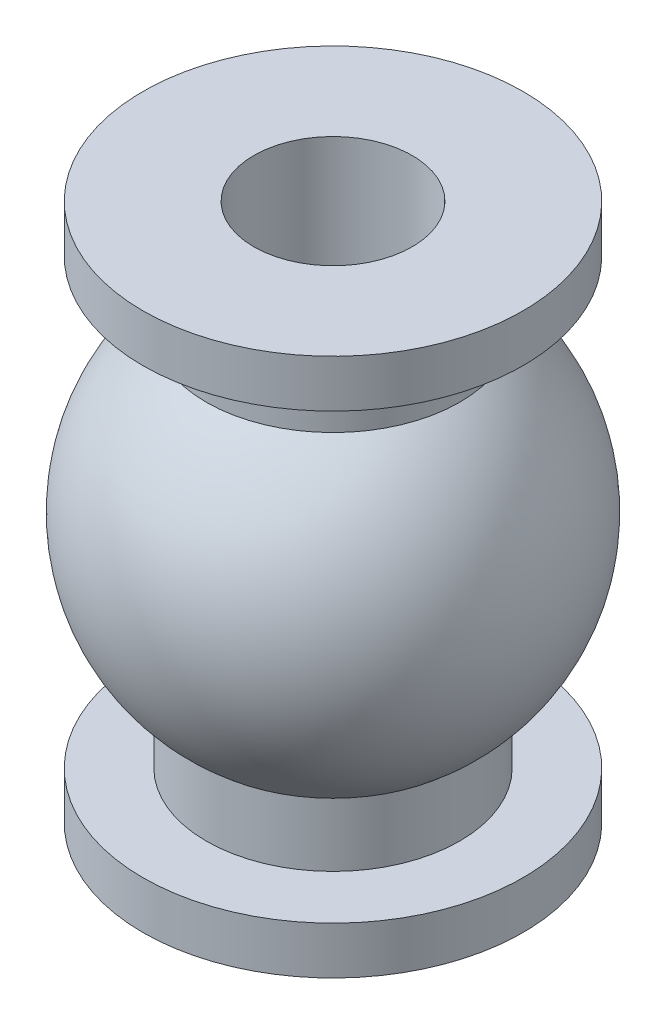
from build123d import *

# Parameters (mm, degrees)
SKETCH2_R          = 2.5
CUT_EXTRUDE1_DEPTH = 20.261360284


with BuildPart() as part:
    # Sketch1 → Revolve1 (revolve)
    with BuildSketch(Plane.XY, mode=Mode.PRIVATE) as revolve1_sk:
        with BuildLine():
            Line((-6, 7), (-4, 7))
            Line((-4, 7), (-4, 5))
            ThreePointArc((-4, 5), (-6.403124237, 0), (-4, -5))
            Line((-4, -5), (-4, -7))
            Line((-4, -7), (-6, -7))
            Line((-6, -7), (-6, -8.5))
            Line((-6, -8.5), (0, -8.5))
            Line((0, -8.5), (0, 8.5))
            Line((0, 8.5), (-6, 8.5))
            Line((-6, 8.5), (-6, 7))
        make_face()
    revolve(revolve1_sk.sketch.rotate(Axis((0, 16.114211291, 0), (0, -1, 0)), 270), axis=Axis((0, 16.114211291, 0), (0, -1, 0)))

    # Sketch2 → Cut-Extrude1 (cut, through all)
    with BuildSketch(Plane(origin=(0, 8.5, 0), x_dir=(1, 0, 0), z_dir=(0, 1, 0))):
        with Locations(Location((0, 0, 0), (0, 0, 270))):
            Circle(SKETCH2_R)
    extrude(amount=-CUT_EXTRUDE1_DEPTH, mode=Mode.SUBTRACT)


solid = part.part
